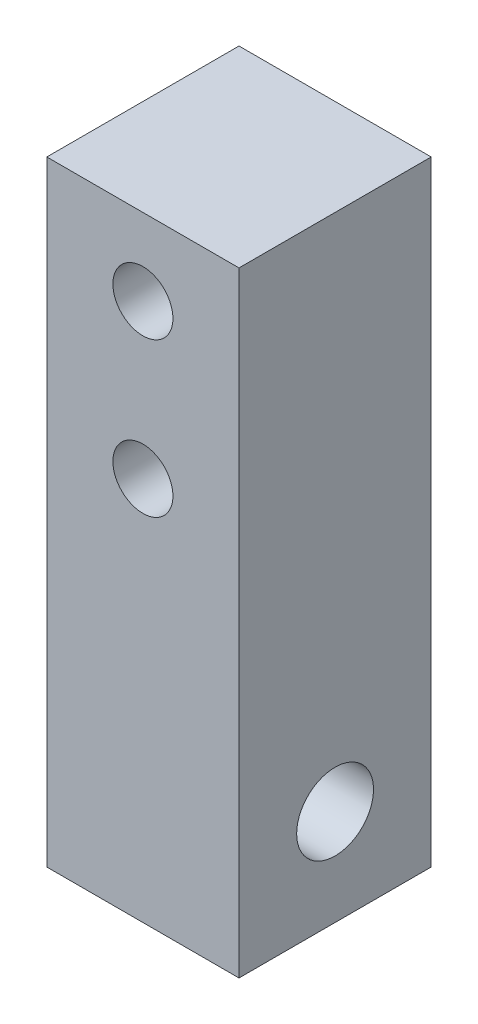
from build123d import *

# Parameters (mm, degrees)
SKETCH1_W           = 31.75
SKETCH1_H           = 101.6
BOSS_EXTRUDE1_DEPTH = 31.75
SKETCH2_R           = 4.9609375
CUT_EXTRUDE1_DEPTH  = 112.079633597
SKETCH3_R           = 6.35
CUT_EXTRUDE2_DEPTH  = 112.079633597


with BuildPart() as part:
    # Sketch1 → Boss-Extrude1 (new body)
    with BuildSketch(Plane.XY):
        with Locations((15.875, 50.8)):
            Rectangle(SKETCH1_W, SKETCH1_H)
    extrude(amount=BOSS_EXTRUDE1_DEPTH)

    # Sketch2 → Cut-Extrude1 (cut, through all)
    with BuildSketch(Plane.XY.offset(31.75)):
        with Locations((15.875, 88.9)):
            Circle(SKETCH2_R)
        with Locations((15.875, 63.5)):
            Circle(SKETCH2_R)
    extrude(amount=-CUT_EXTRUDE1_DEPTH, mode=Mode.SUBTRACT)

    # Sketch3 → Cut-Extrude2 (cut, through all)
    with BuildSketch(Plane.ZY):
        with Locations((15.875, 15.875)):
            Circle(SKETCH3_R)
    extrude(amount=-CUT_EXTRUDE2_DEPTH, mode=Mode.SUBTRACT)


solid = part.part
